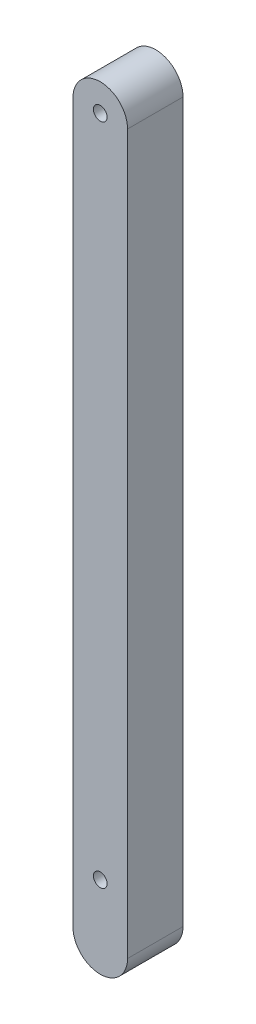
from build123d import *

# Parameters (mm, degrees)
SKETCH1_R           = 1.5
BOSS_EXTRUDE1_DEPTH = 12.2


with BuildPart() as part:
    # Sketch1 → Boss-Extrude1 (new body)
    with BuildSketch(Plane.XY):
        with BuildLine():
            Line((6, 63.609756098), (6, -94.390243902))
            ThreePointArc((6, -94.390243902), (0, -100.390243902), (-6, -94.390243902))
            Line((-6, -94.390243902), (-6, 63.609756098))
            ThreePointArc((-6, 63.609756098), (0, 69.609756098), (6, 63.609756098))
        make_face()
        with Locations((0, -82.390243902)):
            Circle(SKETCH1_R, mode=Mode.SUBTRACT)
        with Locations((0, 63.609756098)):
            Circle(SKETCH1_R, mode=Mode.SUBTRACT)
    extrude(amount=BOSS_EXTRUDE1_DEPTH)


solid = part.part
